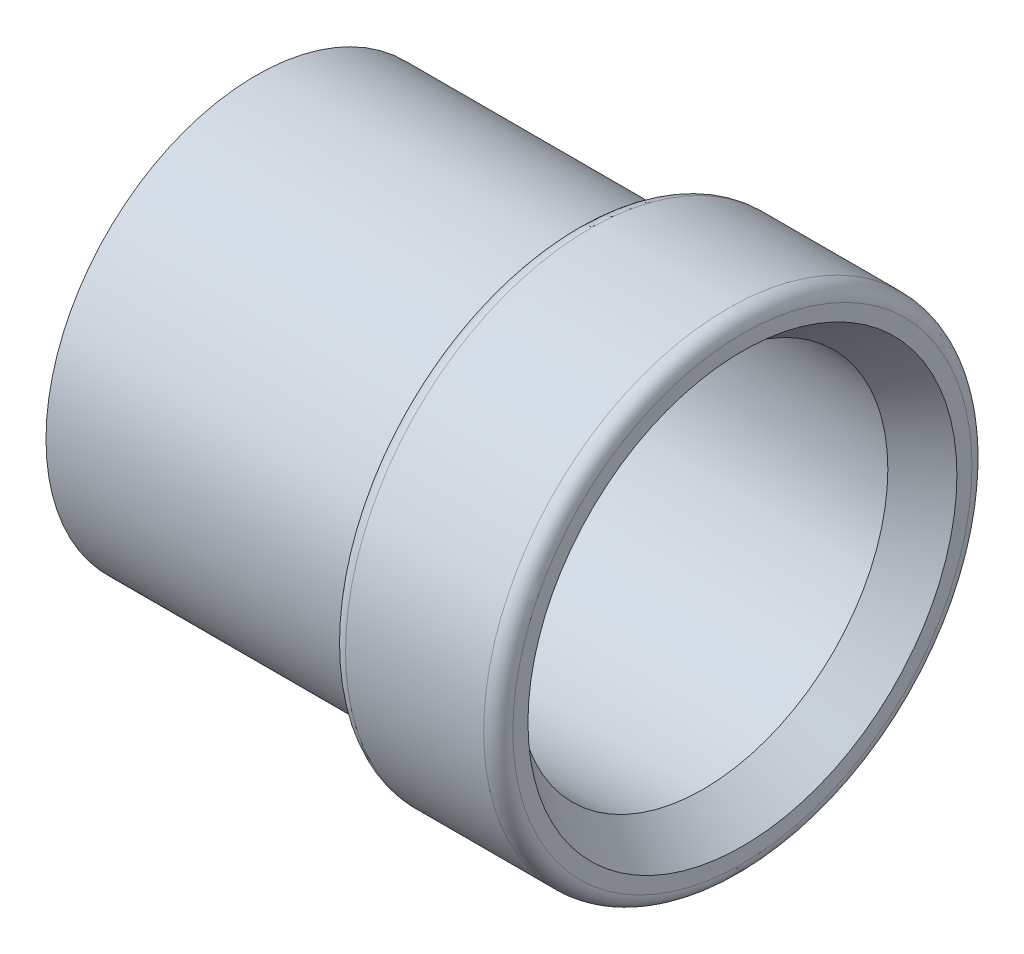
from build123d import *


with BuildPart() as part:
    # Sketch1 → Revolve1 (revolve)
    with BuildSketch(Plane.XY, mode=Mode.PRIVATE) as revolve1_sk:
        with BuildLine():
            Line((-6.35, 4.826), (5.321938377, 4.826))
            Line((5.321938377, 4.826), (6.35, 5.6007))
            Line((6.35, 5.6007), (6.35, 5.9944))
            ThreePointArc((6.35, 5.9944), (6.238407684, 6.263807684), (5.969, 6.3754))
            Line((5.969, 6.3754), (2.3622, 6.3754))
            ThreePointArc((2.3622, 6.3754), (2.092792316, 6.263807684), (1.9812, 5.9944))
            Line((1.9812, 5.9944), (1.9812, 5.4864))
            Line((1.9812, 5.4864), (-6.35, 5.4864))
            Line((-6.35, 5.4864), (-6.35, 4.826))
        make_face()
    revolve(revolve1_sk.sketch.rotate(Axis((-6.35, 0, 0), (1, 0, 0)), 90), axis=Axis((-6.35, 0, 0), (1, 0, 0)))


solid = part.part
